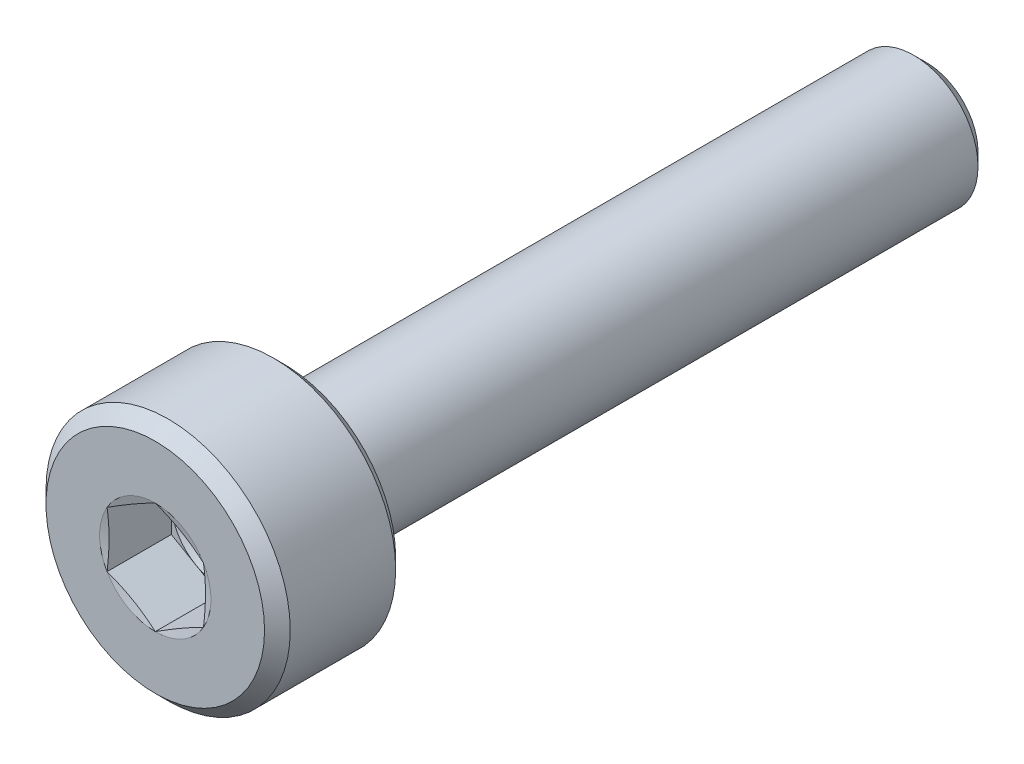
from build123d import *

# Parameters (mm, degrees)
CUT_EXTRUDE1_DEPTH = 1


with BuildPart() as part:
    # Sketch1 → Revolve1 (revolve)
    with BuildSketch(Plane(origin=(0, 0, 0), x_dir=(0, 0, -1), z_dir=(1, 0, 0)), mode=Mode.PRIVATE) as revolve1_sk:
        with BuildLine():
            Line((0, 0), (0, 1.7))
            Line((0, 1.7), (0.2, 1.9))
            Line((0.2, 1.9), (1.84, 1.9))
            Line((1.84, 1.9), (2, 1.74))
            Line((2, 1.74), (2, 1.3))
            ThreePointArc((2, 1.3), (2.015193643, 1.24701055), (2.056157637, 1.210123155))
            Line((2.056157637, 1.210123155), (2.466157637, 1.010123155))
            ThreePointArc((2.466157637, 1.010123155), (2.48750205, 1.00256365), (2.51, 1))
            Line((2.51, 1), (11.8, 1))
            Line((11.8, 1), (12, 0.8))
            Line((12, 0.8), (12, 0))
            Line((12, 0), (0, 0))
        make_face()
    revolve(revolve1_sk.sketch.rotate(Axis((0, 0, 0), (0, 0, -1)), 90), axis=Axis((0, 0, 0), (0, 0, -1)))

    # Sketch2 → Cut-Extrude1 (cut)
    with BuildSketch(Plane.XY):
        Polygon((0, 0.866025404), (-0.75, 0.433012702), (-0.75, -0.433012702), (0, -0.866025404), (0.75, -0.433012702), (0.75, 0.433012702), align=None)
    extrude(amount=-CUT_EXTRUDE1_DEPTH, mode=Mode.SUBTRACT)

    # Sketch3 → Cut-Revolve2 (revolve, cut)
    with BuildSketch(Plane(origin=(0, 0, 0), x_dir=(0, 0, -1), z_dir=(1, 0, 0)), mode=Mode.PRIVATE) as cut_revolve2_sk:
        Polygon((1, 0), (1, 0.75), (1.433012702, 0), align=None)
    revolve(cut_revolve2_sk.sketch.rotate(Axis((0, 0, -1), (0, 0, -1)), 90), axis=Axis((0, 0, -1), (0, 0, -1)), mode=Mode.SUBTRACT)

    # Sketch4 → Cut-Revolve3 (revolve, cut)
    with BuildSketch(Plane(origin=(0, 0, 0), x_dir=(0, 0, -1), z_dir=(1, 0, 0))):
        Polygon((0, 0.866025404), (0, 0.75), (0.031088913, 0.75), align=None)
    revolve(axis=Axis((0, 0, 0), (0, 0, -1)), mode=Mode.SUBTRACT)


solid = part.part
